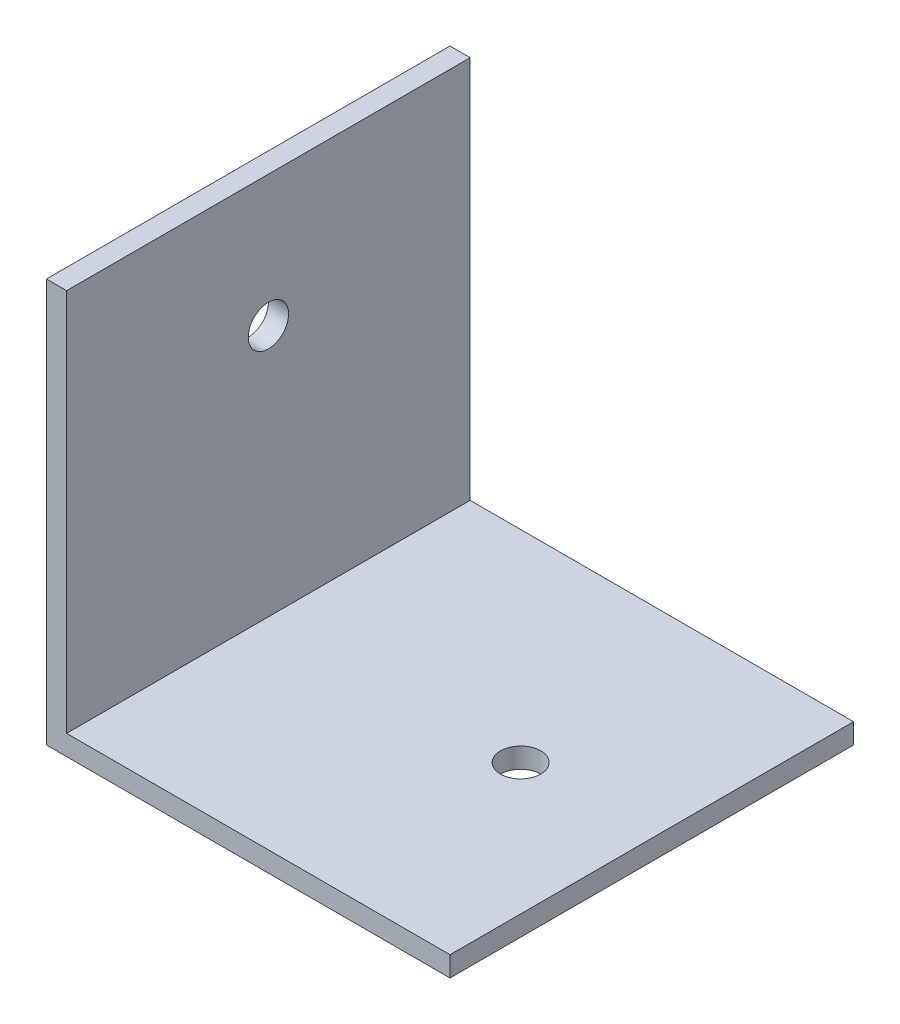
from build123d import *

# Parameters (mm, degrees)
EXTRU_MINCE1_DEPTH      = 20
ESQUISSE2_R             = 1
ENL_V_MAT_EXTRU_1_DEPTH = 1
ESQUISSE3_R             = 1
ENL_V_MAT_EXTRU_2_DEPTH = 1


with BuildPart() as part:
    # Esquisse1 → Extru.-Mince1 (new body)
    with BuildSketch(Plane.XY):
        Polygon((0, 20), (0, 0), (20, 0), (20, 1), (1, 1), (1, 20), align=None)
    extrude(amount=EXTRU_MINCE1_DEPTH)

    # Esquisse2 → Enlèv. mat.-Extru.1 (cut)
    with BuildSketch(Plane(origin=(1, 0, 0), x_dir=(0, 0, -1), z_dir=(1, 0, 0))):
        with Locations((-10, 13.5)):
            Circle(ESQUISSE2_R)
    extrude(amount=-ENL_V_MAT_EXTRU_1_DEPTH, mode=Mode.SUBTRACT)

    # Esquisse3 → Enlèv. mat.-Extru.2 (cut)
    with BuildSketch(Plane(origin=(0, 1, 0), x_dir=(1, 0, 0), z_dir=(0, 1, 0))):
        with Locations(Location((13.5, -10, 0), (0, 0, 270))):
            Circle(ESQUISSE3_R)
    extrude(amount=-ENL_V_MAT_EXTRU_2_DEPTH, mode=Mode.SUBTRACT)


solid = part.part
